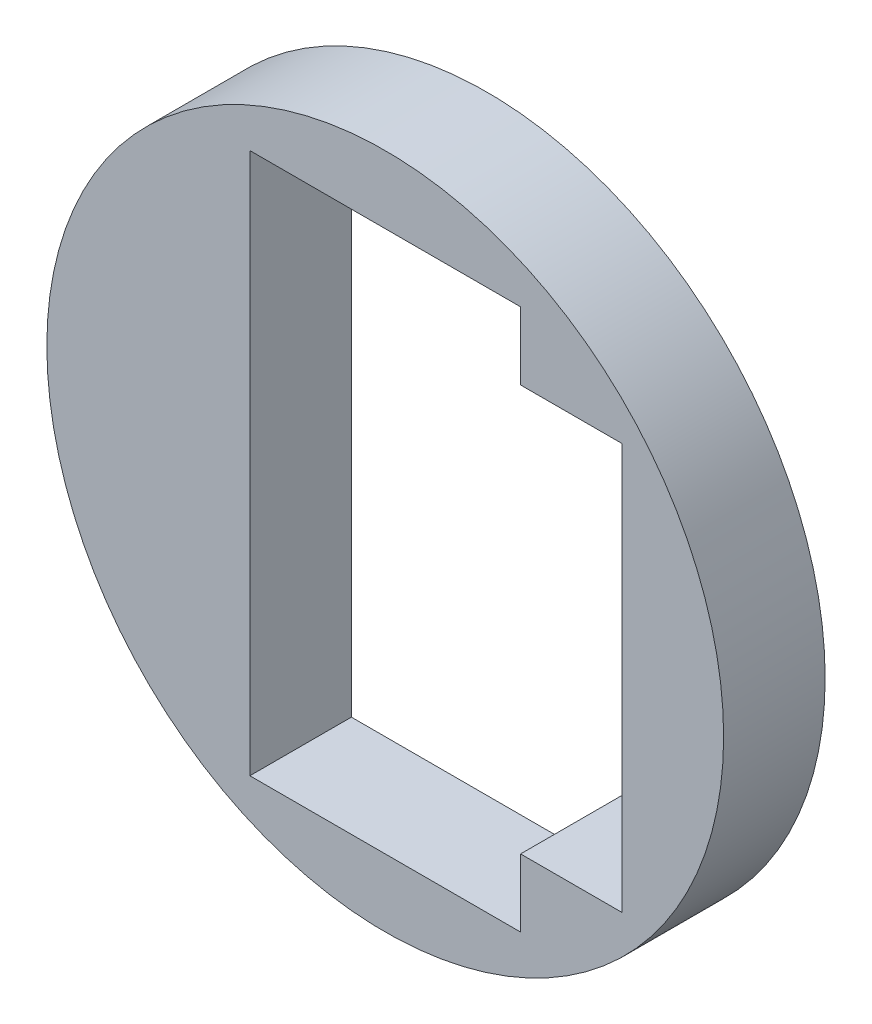
from build123d import *

# Parameters (mm, degrees)
SKETCH1_R           = 10
BOSS_EXTRUDE1_DEPTH = 3
CUT_EXTRUDE1_DEPTH  = 15.456832295


with BuildPart() as part:
    # Sketch1 → Boss-Extrude1 (new body)
    with BuildSketch(Plane.XY):
        Circle(SKETCH1_R)
    extrude(amount=BOSS_EXTRUDE1_DEPTH)

    # Sketch2 → Cut-Extrude1 (cut, through all)
    with BuildSketch(Plane.XY.offset(3)):
        Polygon((-4, 8), (-4, -8), (4, -8), (4, -6), (7, -6), (7, 6), (4, 6), (4, 8), align=None)
    extrude(amount=-CUT_EXTRUDE1_DEPTH, mode=Mode.SUBTRACT)


solid = part.part
